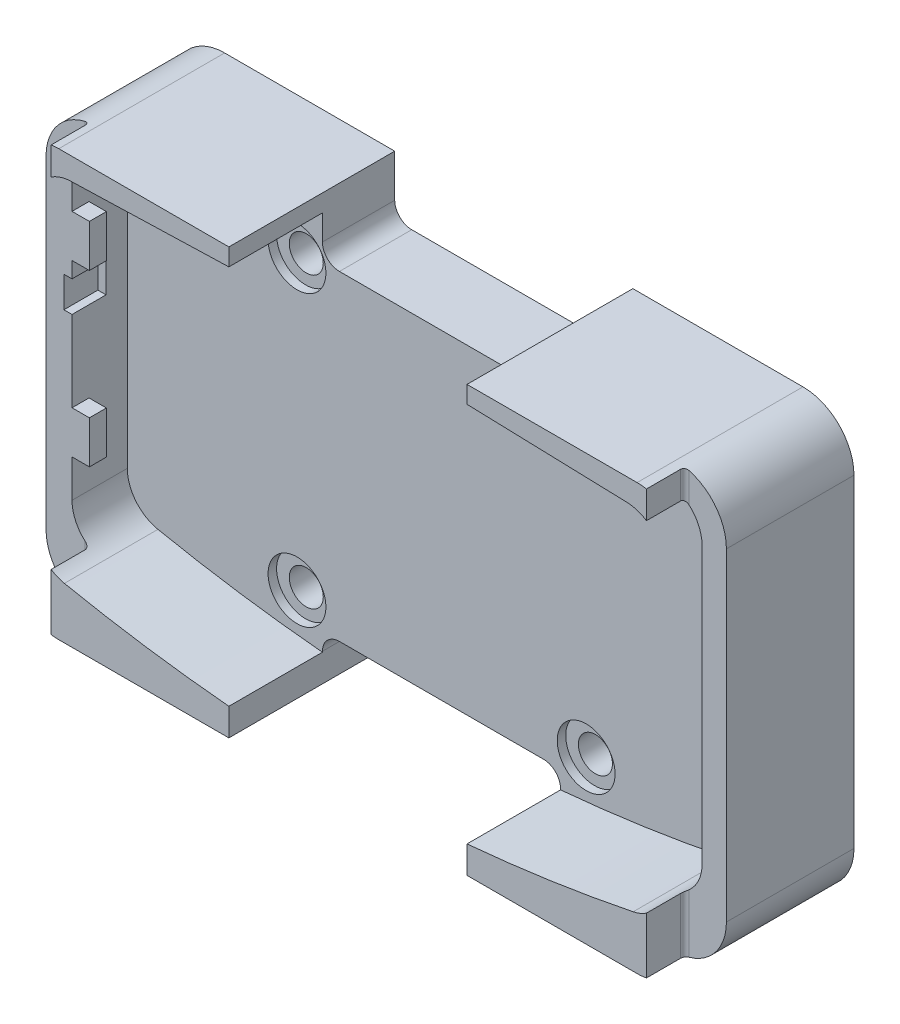
from build123d import *

# Parameters (mm, degrees)
XOR_EXTRUDE1_580_DEPTH          = 11
XOR_EXTRUDE1_580_DEPTH_BACK     = 8.5
XOR_EXTRUDE2_CUT_582_DEPTH      = 23
XOR_EXTRUDE3_CUT_585_DEPTH      = 30
XOR_EXTRUDE3_CUT_585_DEPTH_BACK = 31.5
XOR_SKETCH4_MESH_586_R          = 2
XOR_EXTRUDE4_CUT_587_DEPTH      = 30
XOR_SKETCH5_MESH_588_R          = 3.4
XOR_EXTRUDE5_CUT_949_DEPTH      = 1
XOR_SKETCH6_MESH_1066_W         = 3.25
XOR_SKETCH6_MESH_1066_H         = 5
XOR_SKETCH6_MESH_1066_W_2       = 2.9
XOR_EXTRUDE6_MERGE_1279_DEPTH   = 2
XOR_SKETCH7_MESH_2256_W         = 3
XOR_SKETCH7_MESH_2256_H         = 3.62350981
XOR_EXTRUDE7_CUT_2327_DEPTH     = 4


with BuildPart() as part:
    # XOR_Sketch1 (Mesh)_7 → XOR_Extrude1_580 (new, two sides: drawn at the far end of the back side and taken through both)
    with BuildSketch(Plane.XY.offset(-XOR_EXTRUDE1_580_DEPTH_BACK)):
        with BuildLine():
            Line((11.901247371, 18.104240693), (-12.098752629, 18.104240693))
            ThreePointArc((-12.098752629, 18.104240693), (-13.512966192, 18.690027131), (-14.098752629, 20.104240693))
            Line((-14.098752629, 20.104240693), (-14.098752629, 25.104240693))
            Line((-14.098752629, 25.104240693), (-34.098752629, 25.104240693))
            ThreePointArc((-34.098752629, 25.104240693), (-38.341393316, 23.34688138), (-40.098752629, 19.104240693))
            Line((-40.098752629, 19.104240693), (-40.098752629, -18.895759307))
            ThreePointArc((-40.098752629, -18.895759307), (-38.341393316, -23.138399994), (-34.098752629, -24.895759307))
            Line((-34.098752629, -24.895759307), (-14.098752629, -24.895759307))
            Line((-14.098752629, -24.895759307), (-14.098752629, -21.570783007))
            ThreePointArc((-14.098752629, -21.570783007), (-13.512966192, -20.156569445), (-12.098752629, -19.570783007))
            Line((-12.098752629, -19.570783007), (11.901247371, -19.570783007))
            ThreePointArc((11.901247371, -19.570783007), (13.315460933, -20.156569445), (13.901247371, -21.570783007))
            Line((13.901247371, -21.570783007), (13.901247371, -24.895759307))
            Line((13.901247371, -24.895759307), (33.901247371, -24.895759307))
            ThreePointArc((33.901247371, -24.895759307), (38.143888058, -23.138399994), (39.901247371, -18.895759307))
            Line((39.901247371, -18.895759307), (39.901247371, 19.104240693))
            ThreePointArc((39.901247371, 19.104240693), (38.143888058, 23.34688138), (33.901247371, 25.104240693))
            Line((33.901247371, 25.104240693), (13.901247371, 25.104240693))
            Line((13.901247371, 25.104240693), (13.901247371, 20.104240693))
            ThreePointArc((13.901247371, 20.104240693), (13.315460933, 18.690027131), (11.901247371, 18.104240693))
        make_face()
    extrude(amount=XOR_EXTRUDE1_580_DEPTH + XOR_EXTRUDE1_580_DEPTH_BACK)

    # XOR_Sketch2 (Mesh)_581 → XOR_Extrude2 (Cut)_582 (cut)
    with BuildSketch(Plane.XY):
        with BuildLine():
            Line((37.042591497, 18.002105269), (37.042591497, -14.420226453))
            ThreePointArc((37.042591497, -14.420226453), (36.027448956, -17.267289587), (33.440027724, -18.829830542))
            ThreePointArc((33.440027724, -18.829830542), (16.804364648, -21.403203006), (0, -22.393587061))
            ThreePointArc((0, -22.393587061), (-16.804364648, -21.403203006), (-33.440027724, -18.829830542))
            ThreePointArc((-33.440027724, -18.829830542), (-36.027448956, -17.267289587), (-37.042591497, -14.420226453))
            Line((-37.042591497, -14.420226453), (-37.042591497, 18.002105269))
            ThreePointArc((-37.042591497, 18.002105269), (-35.772866321, 21.135047107), (-32.680225027, 22.5))
            Line((-32.680225027, 22.5), (0, 23.5))
            Line((0, 23.5), (32.680225027, 22.5))
            ThreePointArc((32.680225027, 22.5), (35.772866321, 21.135047107), (37.042591497, 18.002105269))
        make_face()
    extrude(amount=XOR_EXTRUDE2_CUT_582_DEPTH, mode=Mode.SUBTRACT)

    # XOR_Sketch3 (Mesh)_583 → XOR_Extrude3 (Cut)_585 (cut, two sides: drawn at the far end of the back side and taken through both)
    with BuildSketch(Plane(origin=(0, 0, 0), x_dir=(1, 0, 0), z_dir=(0, 1, 0)).offset(-XOR_EXTRUDE3_CUT_585_DEPTH_BACK)):
        with BuildLine():
            Line((35, -7), (35, -20.680063706))
            Line((35, -20.680063706), (45.656007765, -20.680063706))
            Line((45.656007765, -20.680063706), (45.656007765, -6.5))
            Line((45.656007765, -6.5), (35.5, -6.5))
            ThreePointArc((35.5, -6.5), (35.146446609, -6.646446609), (35, -7))
        make_face()
        with BuildLine():
            Line((-45.656007765, -20.680063706), (-45.656007765, -6.5))
            Line((-45.656007765, -6.5), (-35.5, -6.5))
            ThreePointArc((-35.5, -6.5), (-35.146446609, -6.646446609), (-35, -7))
            Line((-35, -7), (-35, -20.680063706))
            Line((-35, -20.680063706), (-45.656007765, -20.680063706))
        make_face()
    extrude(amount=XOR_EXTRUDE3_CUT_585_DEPTH + XOR_EXTRUDE3_CUT_585_DEPTH_BACK, mode=Mode.SUBTRACT)

    # XOR_Sketch4 (Mesh)_586 → XOR_Extrude4 (Cut)_587 (cut)
    with BuildSketch(Plane.XY):
        with Locations((-17, -17)):
            Circle(XOR_SKETCH4_MESH_586_R)
        with Locations((-17, 17)):
            Circle(XOR_SKETCH4_MESH_586_R)
        with Locations((17, -17)):
            Circle(XOR_SKETCH4_MESH_586_R)
        with Locations((17, 17)):
            Circle(XOR_SKETCH4_MESH_586_R)
    extrude(amount=-XOR_EXTRUDE4_CUT_587_DEPTH, mode=Mode.SUBTRACT)

    # XOR_Sketch5 (Mesh)_588 → XOR_Extrude5 (Cut)_949 (cut)
    with BuildSketch(Plane.XY):
        with Locations((16.910776866, 17.14358453)):
            Circle(XOR_SKETCH5_MESH_588_R)
        with Locations((-17.089223134, 17.14358453)):
            Circle(XOR_SKETCH5_MESH_588_R)
        with Locations((16.910776866, -16.85641547)):
            Circle(XOR_SKETCH5_MESH_588_R)
        with Locations((-17.089223134, -16.85641547)):
            Circle(XOR_SKETCH5_MESH_588_R)
    extrude(amount=-XOR_EXTRUDE5_CUT_949_DEPTH, mode=Mode.SUBTRACT)

    # XOR_Sketch6 (Mesh)_1066 → XOR_Extrude6 (Merge)_1279 (add)
    with BuildSketch(Plane.XY.offset(6.5)):
        with Locations((-36.625, -7.5)):
            Rectangle(XOR_SKETCH6_MESH_1066_W, XOR_SKETCH6_MESH_1066_H)
        with Locations((-36.45, 12.5)):
            Rectangle(XOR_SKETCH6_MESH_1066_W_2, XOR_SKETCH6_MESH_1066_H)
    extrude(amount=-XOR_EXTRUDE6_MERGE_1279_DEPTH)

    # XOR_Sketch7 (Mesh)_2256 → XOR_Extrude7 (Cut)_2327 (cut)
    with BuildSketch(Plane.XY.offset(6.5)):
        with Locations((-36.5, 6.311754905)):
            Rectangle(XOR_SKETCH7_MESH_2256_W, XOR_SKETCH7_MESH_2256_H)
    extrude(amount=-XOR_EXTRUDE7_CUT_2327_DEPTH, mode=Mode.SUBTRACT)


solid = part.part
